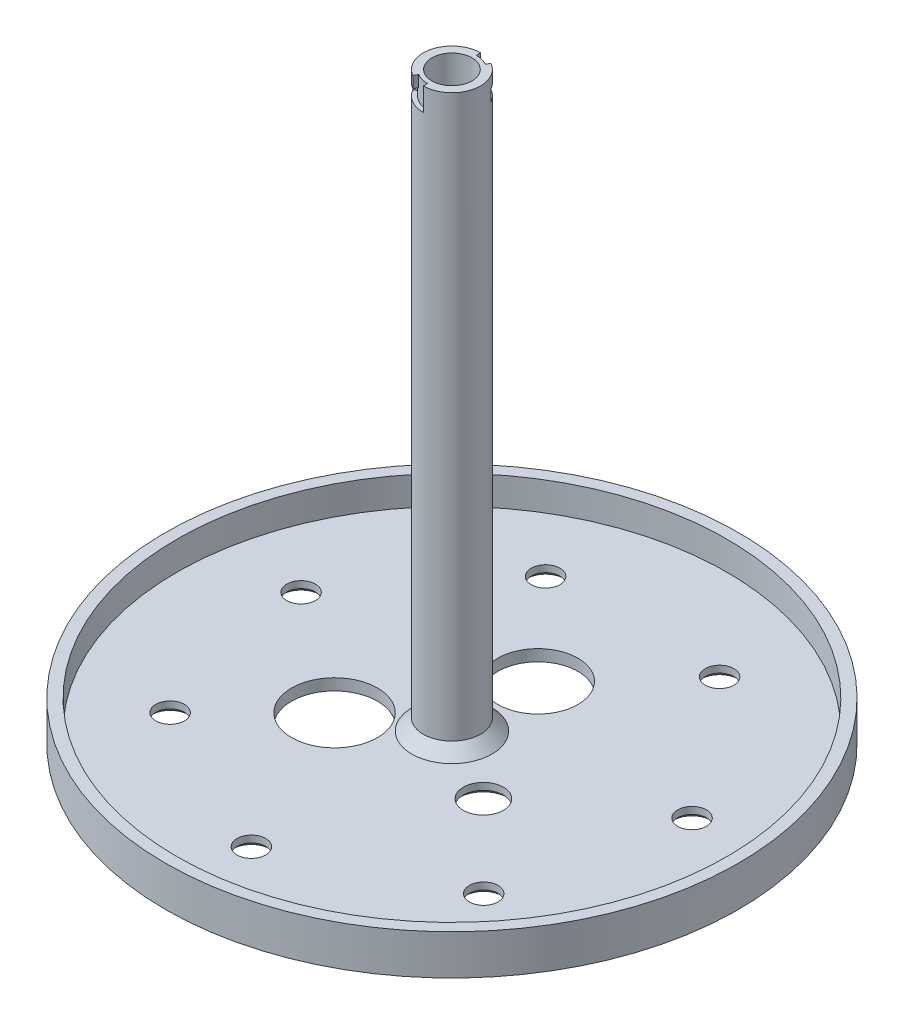
from build123d import *

# Parameters (mm, degrees)
SKETCH1_R                = 48
SKETCH1_R_2              = 7
SKETCH1_R_3              = 7.5
SKETCH1_R_4              = 3.5
BOSS_EXTRUDE1_DEPTH      = 2
SKETCH3_R                = 5
SKETCH3_R_2              = 3.5
BOSS_EXTRUDE2_DEPTH      = 100
CUT_EXTRUDE2_REACH       = 124.523
SKETCH6_R                = 2.5
CHAMFER2_SIZE            = 0.8
SKETCH7_W                = 0.75
SKETCH7_H                = 2
CUT_REVOLVE1_ANGLE       = 30
SKETCH7_4_W              = 0.75
SKETCH7_4_H              = 2
CUT_REVOLVE2_ANGLE       = 60
CIRPATTERN5_COUNT        = 2
BOSS_EXTRUDE3_DEPTH      = 5
BOSS_EXTRUDE3_DEPTH_BACK = 2
SKETCH8_R                = 50
SKETCH8_R_2              = 48
CHAMFER3_SIZE            = 2


with BuildPart() as part:
    # Sketch1 → Boss-Extrude1 (new body)
    with BuildSketch(Plane(origin=(0, 0, 0), x_dir=(1, 0, 0), z_dir=(0, 1, 0))):
        Circle(SKETCH1_R)
        with Locations((0, 15)):
            Circle(SKETCH1_R_2, mode=Mode.SUBTRACT)
        with Locations((-12.990381057, -7.5)):
            Circle(SKETCH1_R_3, mode=Mode.SUBTRACT)
        with Locations((12.990381057, -7.5)):
            Circle(SKETCH1_R_4, mode=Mode.SUBTRACT)
        Circle(SKETCH1_R_4, mode=Mode.SUBTRACT)
    extrude(amount=BOSS_EXTRUDE1_DEPTH)

    # Sketch3 → Boss-Extrude2 (add)
    with BuildSketch(Plane(origin=(0, 2, 0), x_dir=(1, 0, 0), z_dir=(0, 1, 0))):
        Circle(SKETCH3_R)
        Circle(SKETCH3_R_2, mode=Mode.SUBTRACT)
    extrude(amount=BOSS_EXTRUDE2_DEPTH)

    # Sketch6 → Cut-Extrude2 (cut, up to next)
    with BuildSketch(Plane.XZ, mode=Mode.PRIVATE) as cut_extrude2_sk1:
        with Locations((27.364101886, 21.822143065)):
            Circle(SKETCH6_R)
    cut_extrude2_tool1 = extrude(cut_extrude2_sk1.sketch, amount=-CUT_EXTRUDE2_REACH, mode=Mode.PRIVATE) & part.part
    # Sketch6 → Cut-Extrude2 (cut, up to next)
    with BuildSketch(Plane.XZ, mode=Mode.PRIVATE) as cut_extrude2_sk2:
        with Locations((34.122476926, -7.788232688)):
            Circle(SKETCH6_R)
    cut_extrude2_tool2 = extrude(cut_extrude2_sk2.sketch, amount=-CUT_EXTRUDE2_REACH, mode=Mode.PRIVATE) & part.part
    # Sketch6 → Cut-Extrude2 (cut, up to next)
    with BuildSketch(Plane.XZ, mode=Mode.PRIVATE) as cut_extrude2_sk3:
        with Locations((0, 35)):
            Circle(SKETCH6_R)
    cut_extrude2_tool3 = extrude(cut_extrude2_sk3.sketch, amount=-CUT_EXTRUDE2_REACH, mode=Mode.PRIVATE) & part.part
    # Sketch6 → Cut-Extrude2 (cut, up to next)
    with BuildSketch(Plane.XZ, mode=Mode.PRIVATE) as cut_extrude2_sk4:
        with Locations((15.185930869, -31.533910377)):
            Circle(SKETCH6_R)
    cut_extrude2_tool4 = extrude(cut_extrude2_sk4.sketch, amount=-CUT_EXTRUDE2_REACH, mode=Mode.PRIVATE) & part.part
    # Sketch6 → Cut-Extrude2 (cut, up to next)
    with BuildSketch(Plane.XZ, mode=Mode.PRIVATE) as cut_extrude2_sk5:
        with Locations((-27.364101886, 21.822143065)):
            Circle(SKETCH6_R)
    cut_extrude2_tool5 = extrude(cut_extrude2_sk5.sketch, amount=-CUT_EXTRUDE2_REACH, mode=Mode.PRIVATE) & part.part
    # Sketch6 → Cut-Extrude2 (cut, up to next)
    with BuildSketch(Plane.XZ, mode=Mode.PRIVATE) as cut_extrude2_sk6:
        with Locations((-15.185930869, -31.533910377)):
            Circle(SKETCH6_R)
    cut_extrude2_tool6 = extrude(cut_extrude2_sk6.sketch, amount=-CUT_EXTRUDE2_REACH, mode=Mode.PRIVATE) & part.part
    # Sketch6 → Cut-Extrude2 (cut, up to next)
    with BuildSketch(Plane.XZ, mode=Mode.PRIVATE) as cut_extrude2_sk7:
        with Locations((-34.122476926, -7.788232688)):
            Circle(SKETCH6_R)
    cut_extrude2_tool7 = extrude(cut_extrude2_sk7.sketch, amount=-CUT_EXTRUDE2_REACH, mode=Mode.PRIVATE) & part.part
    add(cut_extrude2_tool1.solids().sort_by_distance((27.364102, 0, 21.822143))[0], mode=Mode.SUBTRACT)
    add(cut_extrude2_tool2.solids().sort_by_distance((34.122477, 0, -7.788233))[0], mode=Mode.SUBTRACT)
    add(cut_extrude2_tool3.solids().sort_by_distance((0, 0, 35))[0], mode=Mode.SUBTRACT)
    add(cut_extrude2_tool4.solids().sort_by_distance((15.185931, 0, -31.53391))[0], mode=Mode.SUBTRACT)
    add(cut_extrude2_tool5.solids().sort_by_distance((-27.364102, 0, 21.822143))[0], mode=Mode.SUBTRACT)
    add(cut_extrude2_tool6.solids().sort_by_distance((-15.185931, 0, -31.53391))[0], mode=Mode.SUBTRACT)
    add(cut_extrude2_tool7.solids().sort_by_distance((-34.122477, 0, -7.788233))[0], mode=Mode.SUBTRACT)

    # Chamfer2
    chamfer2_edges = [part.edges().sort_by_distance(p)[0] for p in [
        (-2.5, 0, 35),
        (-29.864101886, 0, 21.822143065),
        (-36.622476926, 0, -7.788232688),
        (-17.685930869, 0, -31.533910377),
        (24.864101886, 0, 21.822143065),
        (9.490381057, 0, 7.5),
        (31.622476926, 0, -7.788232688),
        (12.685930869, 0, -31.533910377),
    ]]
    chamfer(chamfer2_edges, length=CHAMFER2_SIZE)

    # Sketch7 → Cut-Revolve1 (revolve, cut)
    with BuildSketch(Plane(origin=(0, 0, 0), x_dir=(0, 0, -1), z_dir=(1, 0, 0))):
        with Locations((4.625, 101)):
            Rectangle(SKETCH7_W, SKETCH7_H)
    cut_revolve1 = revolve(axis=Axis((0, 102, 0), (0, -1, 0)), revolution_arc=CUT_REVOLVE1_ANGLE, mode=Mode.SUBTRACT)

    # Sketch7<4> → Cut-Revolve2 (revolve, cut)
    with BuildSketch(Plane(origin=(0, 0, 0), x_dir=(0, 0, -1), z_dir=(1, 0, 0))):
        with Locations((4.625, 99)):
            Rectangle(SKETCH7_4_W, SKETCH7_4_H)
    cut_revolve2 = revolve(axis=Axis((0, 102, 0), (0, -1, 0)), revolution_arc=CUT_REVOLVE2_ANGLE, mode=Mode.SUBTRACT)

    # CirPattern5: Cut-Revolve1, Cut-Revolve2 ×2 about axis
    cirpattern5_axis = Axis((0, 102, 0), (0, -1, 0))
    add([cut_revolve1.rotate(cirpattern5_axis, i * 360 / CIRPATTERN5_COUNT) for i in range(1, CIRPATTERN5_COUNT)], mode=Mode.SUBTRACT)
    add([cut_revolve2.rotate(cirpattern5_axis, i * 360 / CIRPATTERN5_COUNT) for i in range(1, CIRPATTERN5_COUNT)], mode=Mode.SUBTRACT)

    # Chamfer3
    chamfer3_edges = [part.edges().sort_by_distance(p)[0] for p in [
        (-5, 2, 0),
    ]]
    chamfer(chamfer3_edges, length=CHAMFER3_SIZE)


with BuildPart() as body_2:
    # Sketch8 → Boss-Extrude3 (new, two sides: drawn at the far end of the back side and taken through both)
    with BuildSketch(Plane(origin=(0, 2, 0), x_dir=(1, 0, 0), z_dir=(0, 1, 0)).offset(-BOSS_EXTRUDE3_DEPTH_BACK)):
        Circle(SKETCH8_R)
        Circle(SKETCH8_R_2, mode=Mode.SUBTRACT)
    extrude(amount=BOSS_EXTRUDE3_DEPTH + BOSS_EXTRUDE3_DEPTH_BACK)


solid = Compound([part.part, body_2.part])
